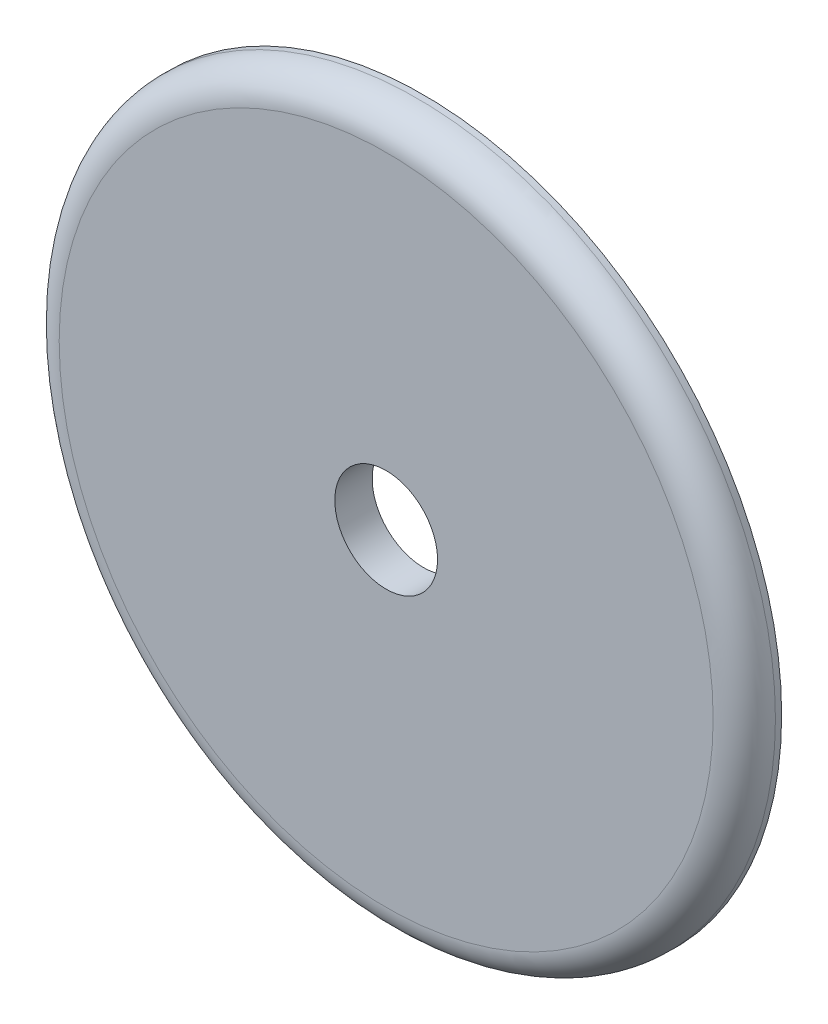
from build123d import *

# Parameters (mm, degrees)
SKETCH1_R           = 11.5
SKETCH1_R_2         = 1.65
BOSS_EXTRUDE1_DEPTH = 1.2
FILLET1_R           = 1


with BuildPart() as part:
    # Sketch1 → Boss-Extrude1 (new body)
    with BuildSketch(Plane.XY):
        Circle(SKETCH1_R)
        Circle(SKETCH1_R_2, mode=Mode.SUBTRACT)
    extrude(amount=BOSS_EXTRUDE1_DEPTH)

    # Fillet1
    fillet1_edges = [part.edges().sort_by_distance(p)[0] for p in [
        (-11.5, 0, 1.2),
    ]]
    fillet(fillet1_edges, radius=FILLET1_R)


solid = part.part
